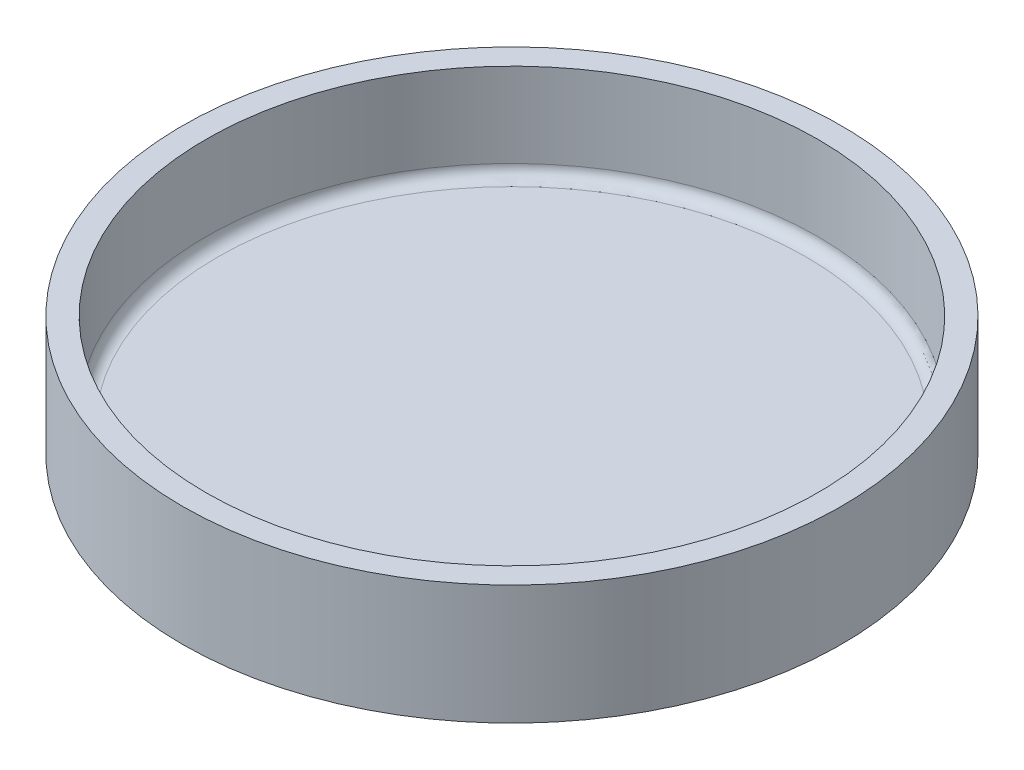
from build123d import *

# Parameters (mm, degrees)
SKETCH1_R           = 70
SKETCH1_R_2         = 65
SKETCH1_R_3         = 55
BOSS_EXTRUDE1_DEPTH = 5
SKETCH2_R           = 70
SKETCH2_R_2         = 65
BOSS_EXTRUDE2_DEPTH = 20.4
FILLET1_R           = 2.5


with BuildPart() as part:
    # Sketch1 → Boss-Extrude1 (new body)
    # profile 1 of 3: a face of its own
    with BuildSketch(Plane(origin=(0, 0, 0), x_dir=(1, 0, 0), z_dir=(0, 1, 0))):
        with Locations(Location((0, 0, 0), (0, 0, 270))):
            Circle(SKETCH1_R)
        Circle(SKETCH1_R_2, mode=Mode.SUBTRACT)
    # profile 2 of 3: a face of its own
    with BuildSketch(Plane(origin=(0, 0, 0), x_dir=(1, 0, 0), z_dir=(0, 1, 0))):
        Circle(SKETCH1_R_2)
        Circle(SKETCH1_R_3, mode=Mode.SUBTRACT)
    # profile 3 of 3: a face of its own
    with BuildSketch(Plane(origin=(0, 0, 0), x_dir=(1, 0, 0), z_dir=(0, 1, 0))):
        Circle(SKETCH1_R_3)
    extrude(amount=BOSS_EXTRUDE1_DEPTH)

    # Sketch2 → Boss-Extrude2 (add)
    with BuildSketch(Plane(origin=(0, 5, 0), x_dir=(1, 0, 0), z_dir=(0, 1, 0))):
        with Locations(Location((0, 0, 0), (0, 0, 270))):
            Circle(SKETCH2_R)
        with Locations(Location((0, 0, 0), (0, 0, 270))):
            Circle(SKETCH2_R_2, mode=Mode.SUBTRACT)
    extrude(amount=BOSS_EXTRUDE2_DEPTH)

    # Fillet1
    fillet1_edges = [part.edges().sort_by_distance(p)[0] for p in [
        (0, 5, -65),
    ]]
    fillet(fillet1_edges, radius=FILLET1_R)


solid = part.part
